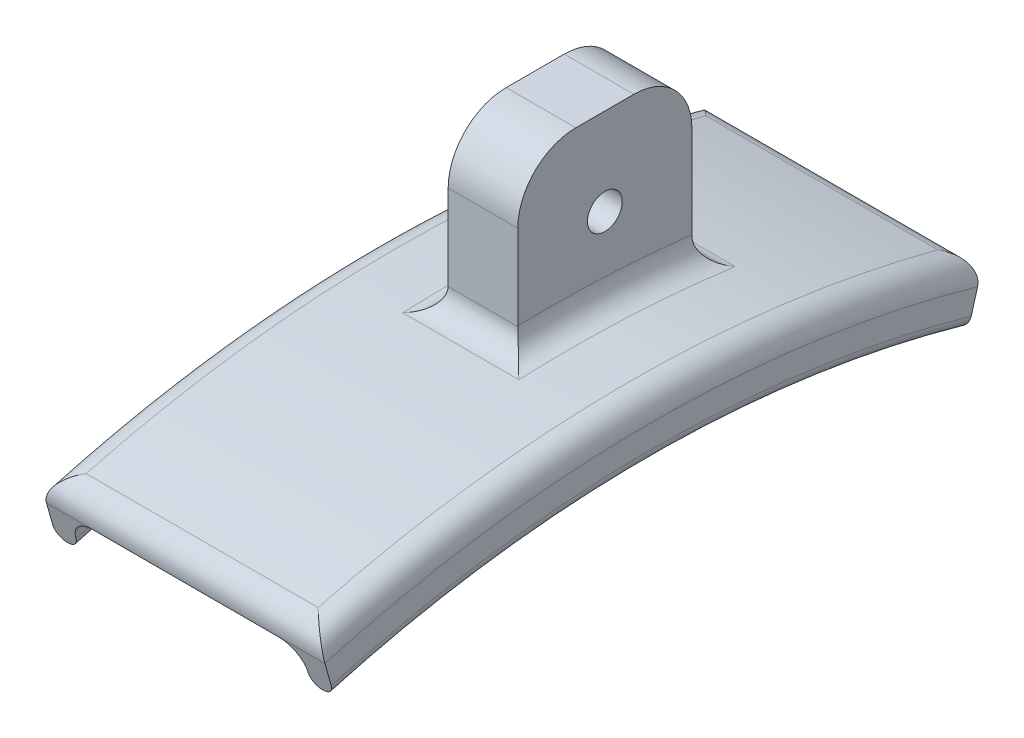
from build123d import *

# Parameters (mm, degrees)
SALIENTE_EXTRUIR1_DEPTH = 12
CROQUIS7_R              = 1.5
SALIENTE_EXTRUIR2_DEPTH = 3
REDONDEO1_R             = 2
REDONDEO2_R             = 1
REDONDEO3_R             = 1


with BuildPart() as part:
    # Croquis1 → Saliente-Extruir1 (new, symmetric)
    with BuildSketch(Plane(origin=(0, 0, 0), x_dir=(0, 0, -1), z_dir=(1, 0, 0))):
        with BuildLine():
            Line((-27.304944607, -3.8), (-28.670191838, 1.01))
            ThreePointArc((-28.670191838, 1.01), (0, 5), (28.670191838, 1.01))
            Line((28.670191838, 1.01), (27.304944607, -3.8))
            ThreePointArc((27.304944607, -3.8), (0, 0), (-27.304944607, -3.8))
        make_face()
    extrude(amount=SALIENTE_EXTRUIR1_DEPTH, both=True)

    # Croquis7 → Saliente-Extruir2 (add, symmetric)
    with BuildSketch(Plane(origin=(0, 0, 0), x_dir=(0, 0, -1), z_dir=(1, 0, 0))):
        with BuildLine():
            Line((2.5, 19.25329731), (7.5, 19.25329731))
            ThreePointArc((7.5, 19.25329731), (11.035533906, 17.788831216), (12.5, 14.25329731))
            Line((12.5, 14.25329731), (12.5, 4.25329731))
            ThreePointArc((12.5, 4.25329731), (5.012833481, 4.880272218), (-2.5, 4.970233876))
            Line((-2.5, 4.970233876), (-2.5, 14.25329731))
            ThreePointArc((-2.5, 14.25329731), (-1.035533906, 17.788831216), (2.5, 19.25329731))
        make_face()
        with Locations((5, 11.75329731)):
            Circle(CROQUIS7_R, mode=Mode.SUBTRACT)
    extrude(amount=SALIENTE_EXTRUIR2_DEPTH, both=True)

    # Redondeo1
    redondeo1_edges = [part.edges().sort_by_distance(p)[0] for p in [
        (12, 5, 0),
        (3, 4.880272218, -5.012833481),
        (-3, 4.880272218, -5.012833481),
        (0, 4.970233876, 2.5),
        (0, 4.25329731, -12.5),
        (-12, 5, 0),
        (0, 1.01, 28.670191838),
        (0, 1.01, -28.670191838),
    ]]
    fillet(redondeo1_edges, radius=REDONDEO1_R)

    # Croquis11 → Cortar-Revolución1 (revolve, cut)
    with BuildSketch(Plane(origin=(0, -7.4556, 26.267356712), x_dir=(1, 0, 0), z_dir=(0, -0.2730494460715864, 0.9619999999999999))):
        with BuildLine():
            Line((-8, 6.780580694), (8, 6.780580694))
            ThreePointArc((8, 6.780580694), (9.414213562, 6.194794256), (10, 4.780580694))
            Line((10, 4.780580694), (10, 3.8))
            Line((10, 3.8), (-10, 3.8))
            Line((-10, 3.8), (-10, 4.780580694))
            ThreePointArc((-10, 4.780580694), (-9.414213562, 6.194794256), (-8, 6.780580694))
        make_face()
    revolve(axis=Axis((12, -100, 0), (-1, 0, 0)), mode=Mode.SUBTRACT)

    # Redondeo2
    redondeo2_edges = [part.edges().sort_by_distance(p)[0] for p in [
        (-10, 0, 0),
        (10, 0, 0),
    ]]
    fillet(redondeo2_edges, radius=REDONDEO2_R)

    # Redondeo3
    redondeo3_edges = [part.edges().sort_by_distance(p)[0] for p in [
        (12, 0, 0),
        (-12, 0, 0),
    ]]
    fillet(redondeo3_edges, radius=REDONDEO3_R)


solid = part.part
